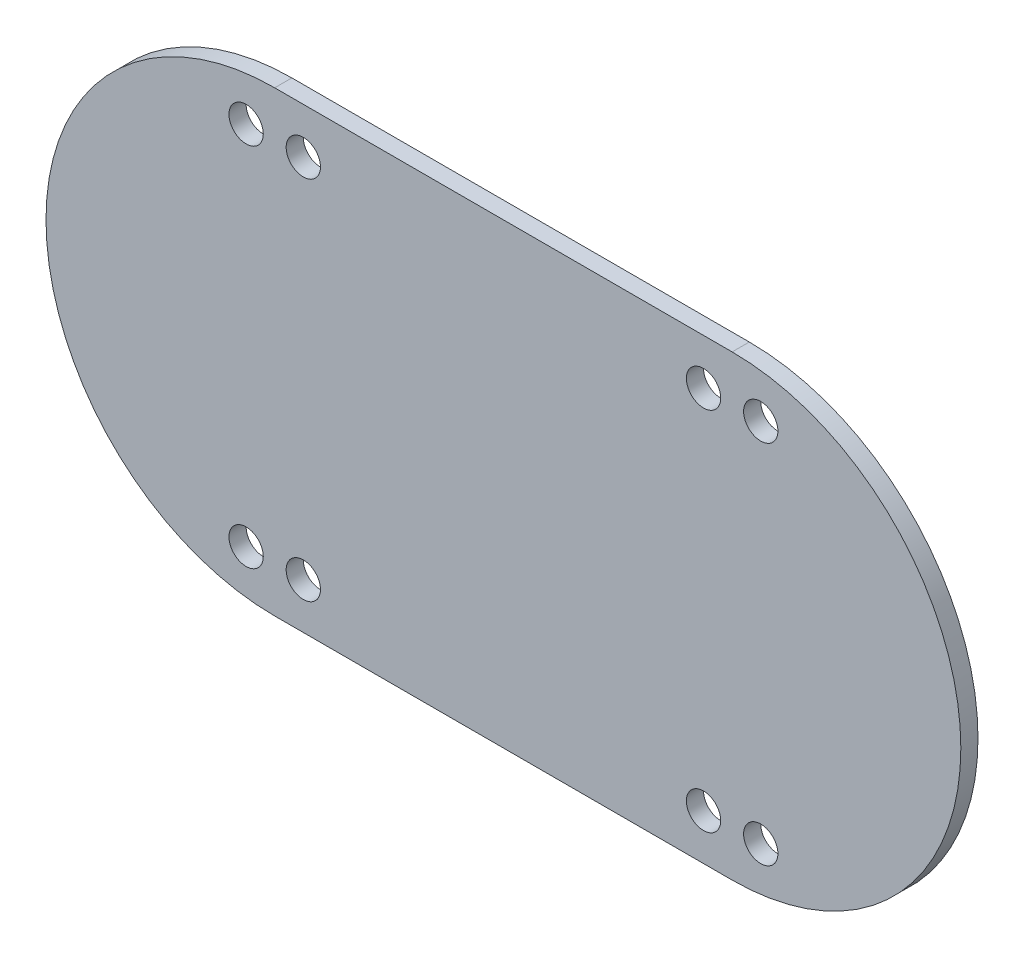
from build123d import *

# Parameters (mm, degrees)
SKETCH1_R           = 3
BOSS_EXTRUDE1_DEPTH = 3


with BuildPart() as part:
    # Sketch1 → Boss-Extrude1 (new body)
    with BuildSketch(Plane.XY):
        with BuildLine():
            Line((40, 40.219178082), (-40, 40.219178082))
            ThreePointArc((-40, 40.219178082), (-80, 0.219178082), (-40, -39.780821918))
            Line((-40, -39.780821918), (40, -39.780821918))
            ThreePointArc((40, -39.780821918), (80, 0.219178082), (40, 40.219178082))
        make_face()
        with Locations((45, 32.219178082)):
            Circle(SKETCH1_R, mode=Mode.SUBTRACT)
        with Locations((45, -31.780821918)):
            Circle(SKETCH1_R, mode=Mode.SUBTRACT)
        with Locations((-45, 32.219178082)):
            Circle(SKETCH1_R, mode=Mode.SUBTRACT)
        with Locations((-45, -31.780821918)):
            Circle(SKETCH1_R, mode=Mode.SUBTRACT)
        with Locations((35, 32.219178082)):
            Circle(SKETCH1_R, mode=Mode.SUBTRACT)
        with Locations((-35, 32.219178082)):
            Circle(SKETCH1_R, mode=Mode.SUBTRACT)
        with Locations((-35, -31.780821918)):
            Circle(SKETCH1_R, mode=Mode.SUBTRACT)
        with Locations((35, -31.780821918)):
            Circle(SKETCH1_R, mode=Mode.SUBTRACT)
    extrude(amount=BOSS_EXTRUDE1_DEPTH)


solid = part.part
